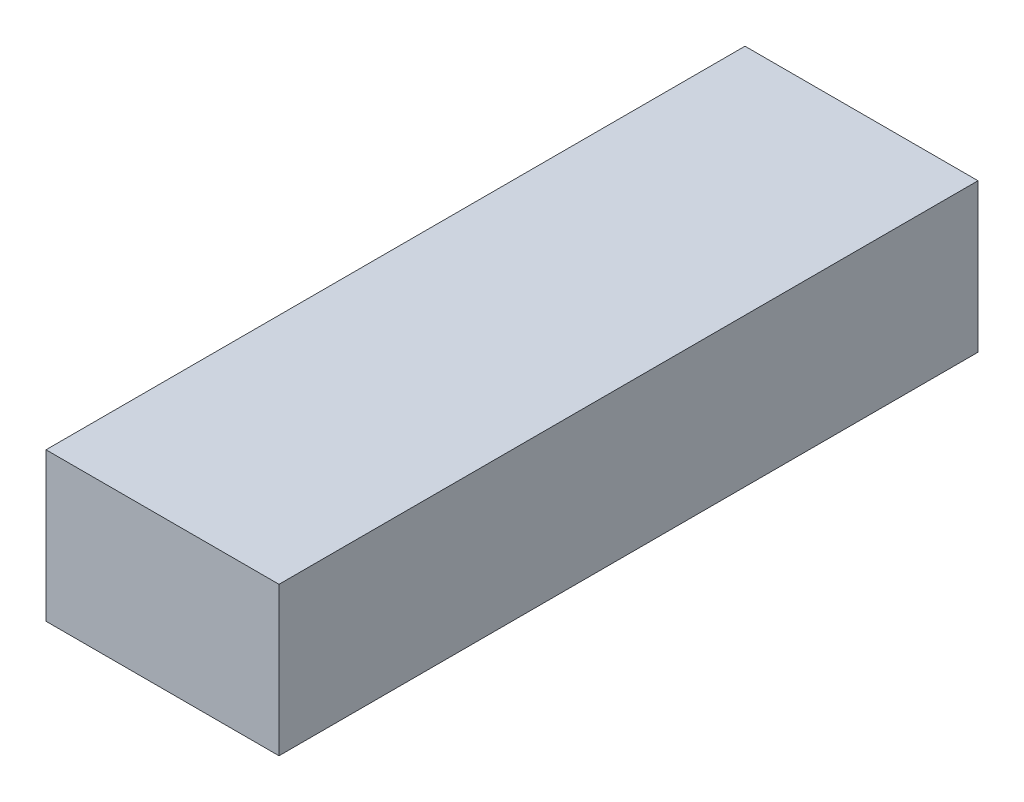
from build123d import *

# Parameters (mm, degrees)
ESQUISSE1_W        = 40
ESQUISSE1_H        = 25.5
BOSS_EXTRU_1_DEPTH = 120


with BuildPart() as part:
    # Esquisse1 → Boss.-Extru.1 (new body)
    with BuildSketch(Plane.XY):
        with Locations((20, 12.75)):
            Rectangle(ESQUISSE1_W, ESQUISSE1_H)
    extrude(amount=BOSS_EXTRU_1_DEPTH)


solid = part.part
